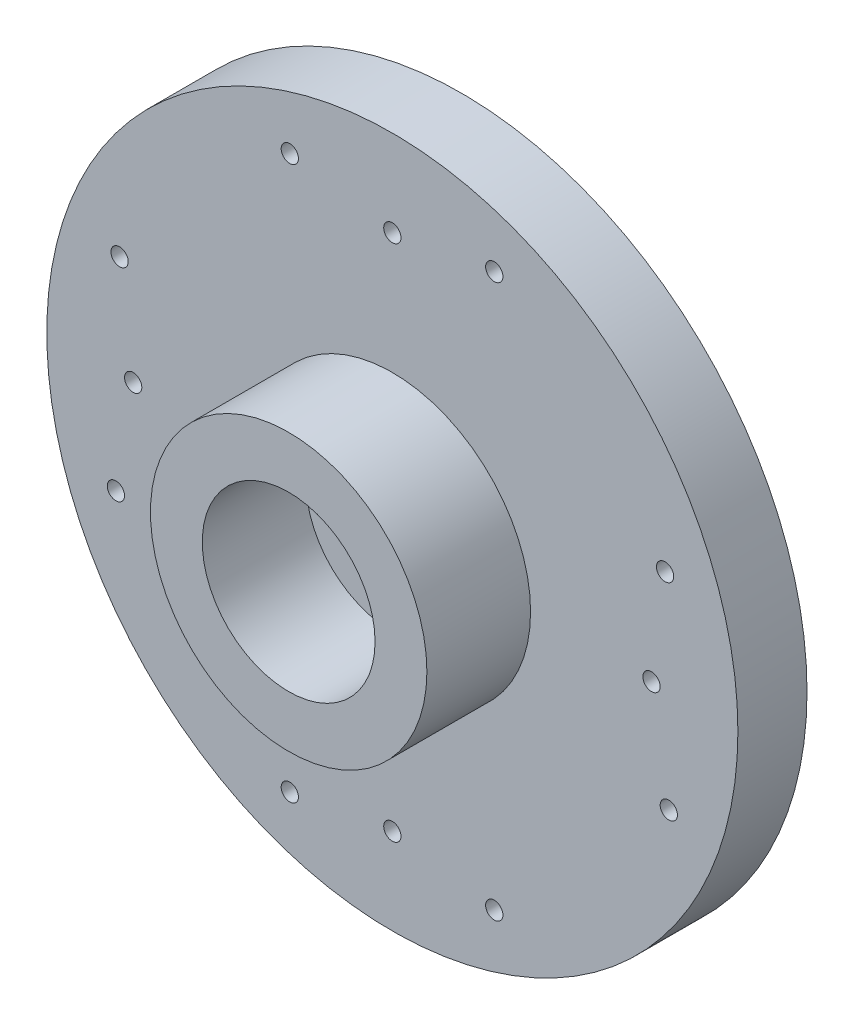
from build123d import *

# Parameters (mm, degrees)
ESQUISSE1_R             = 12
ESQUISSE1_R_2           = 1.2
BOSS_EXTRU_2_DEPTH      = 2.4
ESQUISSE3_R             = 4.8
ESQUISSE3_R_2           = 3
BOSS_EXTRU_3_DEPTH      = 3.6
ESQUISSE4_R             = 0.3
ENL_V_MAT_EXTRU_1_DEPTH = 3.6
ESQUISSE5_R             = 3.6
ENL_V_MAT_EXTRU_2_DEPTH = 0.6


with BuildPart() as part:
    # Esquisse1 → Boss.-Extru.2 (new body)
    with BuildSketch(Plane.XY):
        Circle(ESQUISSE1_R)
        Circle(ESQUISSE1_R_2, mode=Mode.SUBTRACT)
    extrude(amount=BOSS_EXTRU_2_DEPTH)

    # Esquisse3 → Boss.-Extru.3 (add)
    with BuildSketch(Plane.XY.offset(2.4)):
        Circle(ESQUISSE3_R)
        Circle(ESQUISSE3_R_2, mode=Mode.SUBTRACT)
    extrude(amount=BOSS_EXTRU_3_DEPTH)

    # Esquisse4 → Enlèv. mat.-Extru.1 (cut)
    with BuildSketch(Plane.XY.offset(2.4)):
        with Locations((-9.6, -3.560674829)):
            Circle(ESQUISSE4_R)
        with Locations((-3.560674829, 9.6)):
            Circle(ESQUISSE4_R)
        with Locations((-9, 0)):
            Circle(ESQUISSE4_R)
        with Locations((-9.471169928, 3.542156917)):
            Circle(ESQUISSE4_R)
        with Locations((0, 9)):
            Circle(ESQUISSE4_R)
        with Locations((3.539325171, 9.6)):
            Circle(ESQUISSE4_R)
        with Locations((9.6, -3.560674829)):
            Circle(ESQUISSE4_R)
        with Locations((9, 0)):
            Circle(ESQUISSE4_R)
        with Locations((9.471169928, 3.542156917)):
            Circle(ESQUISSE4_R)
        with Locations((3.539325171, -9.6)):
            Circle(ESQUISSE4_R)
        with Locations((0, -9)):
            Circle(ESQUISSE4_R)
        with Locations((-3.560674829, -9.6)):
            Circle(ESQUISSE4_R)
    extrude(amount=-ENL_V_MAT_EXTRU_1_DEPTH, mode=Mode.SUBTRACT)

    # Esquisse5 → Enlèv. mat.-Extru.2 (cut)
    with BuildSketch(Plane(origin=(0, 0, 0), x_dir=(-1, 0, 0), z_dir=(0, 0, -1))):
        Circle(ESQUISSE5_R)
    extrude(amount=-ENL_V_MAT_EXTRU_2_DEPTH, mode=Mode.SUBTRACT)


solid = part.part
